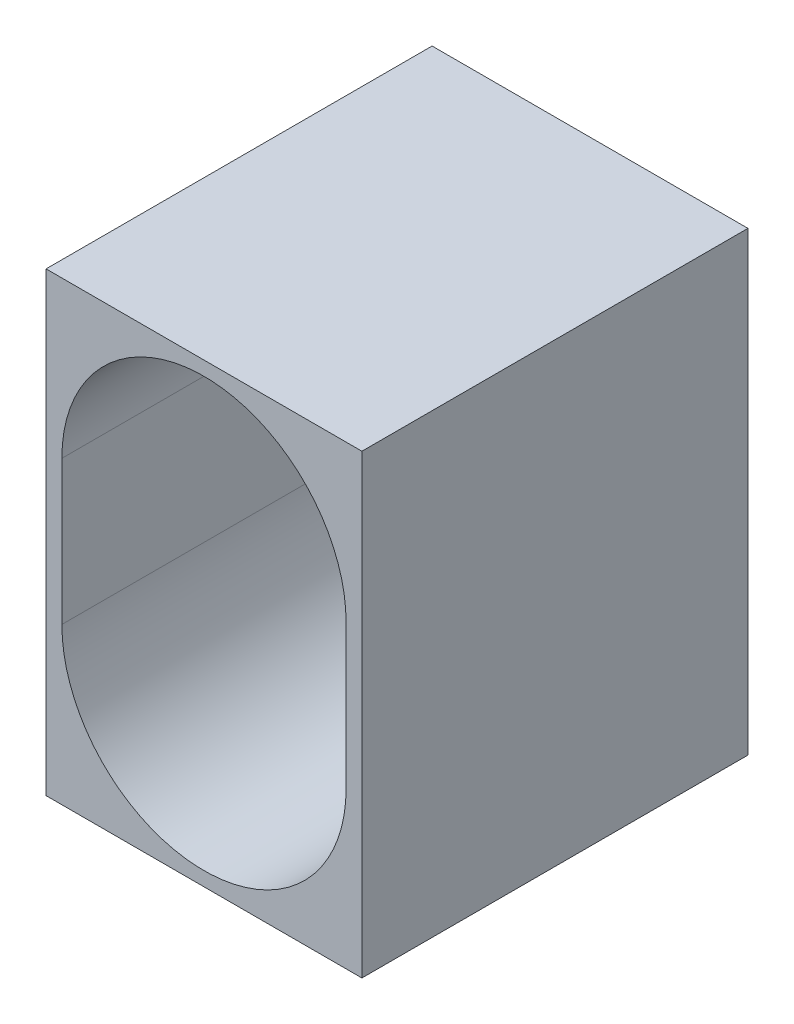
from build123d import *

# Parameters (mm, degrees)
SKETCH4_W               = 45
SKETCH4_H               = 65
BOSS_EXTRUDE2_DEPTH     = 55
CUT_EXTRUDE1_DEPTH      = 52.5
F_1_4_28_TAPPED_HOLE1_D = 5.4102


with BuildPart() as part:
    # Sketch4 → Boss-Extrude2 (new body)
    with BuildSketch(Plane.XY):
        with Locations((-7.784904398, -11.939291809)):
            Rectangle(SKETCH4_W, SKETCH4_H)
    extrude(amount=BOSS_EXTRUDE2_DEPTH)

    # Sketch5 → Cut-Extrude1 (cut)
    with BuildSketch(Plane.XY.offset(55)):
        with BuildLine():
            Line((-28.034904398, -22.189291809), (-28.034904398, -1.689291809))
            ThreePointArc((-28.034904398, -1.689291809), (-7.784904398, 18.560708191), (12.465095602, -1.689291809))
            Line((12.465095602, -1.689291809), (12.465095602, -22.189291809))
            ThreePointArc((12.465095602, -22.189291809), (-7.784904398, -42.439291809), (-28.034904398, -22.189291809))
        make_face()
    extrude(amount=-CUT_EXTRUDE1_DEPTH, mode=Mode.SUBTRACT)

    # 1/4-28 Tapped Hole1 (through all)
    with Locations(Plane(origin=(0, 0, 0), x_dir=(-1, 0, 0), z_dir=(0, 0, -1))):
        with Locations((7.784904398, -16.439291809)):
            Hole(F_1_4_28_TAPPED_HOLE1_D / 2)


solid = part.part
